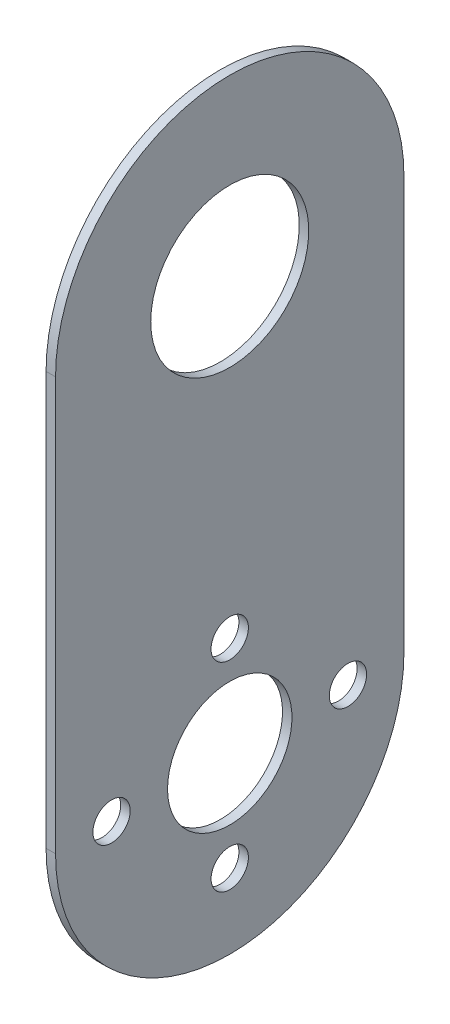
from build123d import *

# Parameters (mm, degrees)
SKETCH1_R           = 6.35
SKETCH1_R_2         = 1.5
SKETCH1_R_3         = 5
BOSS_EXTRUDE1_DEPTH = 0.762


with BuildPart() as part:
    # Sketch1 → Boss-Extrude1 (new body)
    with BuildSketch(Plane(origin=(0, 0, 0), x_dir=(0, 0, -1), z_dir=(1, 0, 0))):
        with BuildLine():
            Line((14.00048, 0), (14.00048, -33.1978))
            ThreePointArc((14.00048, -33.1978), (0, -47.19828), (-14.00048, -33.1978))
            Line((-14.00048, -33.1978), (-14.00048, 0))
            ThreePointArc((-14.00048, 0), (0, 14.00048), (14.00048, 0))
        make_face()
        with Locations(Location((0, 0, 0), (0, 0, 180))):
            Circle(SKETCH1_R, mode=Mode.SUBTRACT)
        with Locations(Location((0, -25.1978, 0), (0, 0, 180))):
            Circle(SKETCH1_R_2, mode=Mode.SUBTRACT)
        with Locations(Location((0, -41.1978, 0), (0, 0, 180))):
            Circle(SKETCH1_R_2, mode=Mode.SUBTRACT)
        with Locations(Location((-9.5, -33.1978, 0), (0, 0, 180))):
            Circle(SKETCH1_R_2, mode=Mode.SUBTRACT)
        with Locations(Location((9.5, -33.1978, 0), (0, 0, 180))):
            Circle(SKETCH1_R_2, mode=Mode.SUBTRACT)
        with Locations(Location((0, -33.1978, 0), (0, 0, 180))):
            Circle(SKETCH1_R_3, mode=Mode.SUBTRACT)
    extrude(amount=BOSS_EXTRUDE1_DEPTH)


solid = part.part
